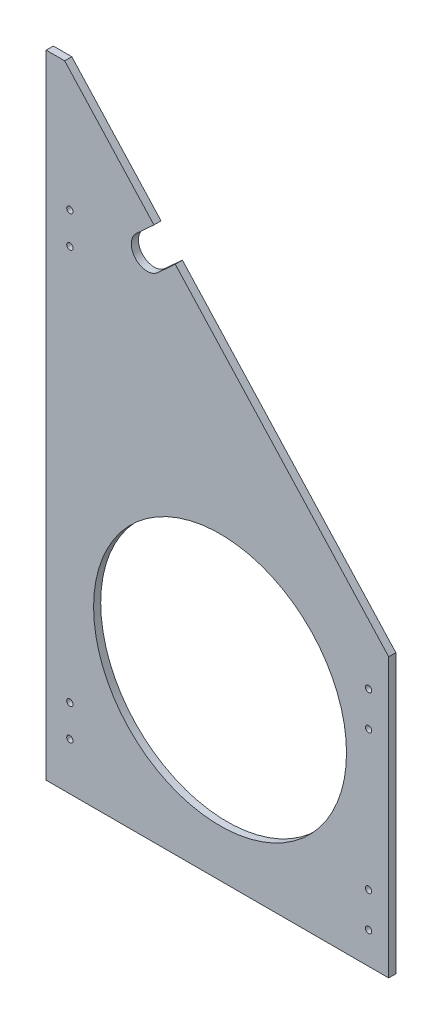
from build123d import *

# Parameters (mm, degrees)
SKETCH_1_R          = 80
EXTRUDE_1_DEPTH     = 4.5
CUT_EXTRUDE_1_REACH = 456.95
SKETCH_2_R          = 2


with BuildPart() as part:
    # 草图1 → 凸台-拉伸1 (new body)
    with BuildSketch(Plane.XY):
        Polygon((0, 0), (216.7, 0), (216.7, 176), (11.7, 400), (0, 400), align=None)
        with Locations((110, 110)):
            Circle(SKETCH_1_R, mode=Mode.SUBTRACT)
    extrude(amount=EXTRUDE_1_DEPTH)

    # 草图2 → 切除-拉伸1 (cut, up to next)
    with BuildSketch(Plane.XY.offset(4.5), mode=Mode.PRIVATE) as cut_extrude_1_sk1:
        with Locations((203.95, 20)):
            Circle(SKETCH_2_R)
    cut_extrude_1_tool1 = extrude(cut_extrude_1_sk1.sketch, amount=-CUT_EXTRUDE_1_REACH, mode=Mode.PRIVATE) & part.part
    # 草图2 → 切除-拉伸1 (cut, up to next)
    with BuildSketch(Plane.XY.offset(4.5), mode=Mode.PRIVATE) as cut_extrude_1_sk2:
        with Locations((203.95, 42)):
            Circle(SKETCH_2_R)
    cut_extrude_1_tool2 = extrude(cut_extrude_1_sk2.sketch, amount=-CUT_EXTRUDE_1_REACH, mode=Mode.PRIVATE) & part.part
    # 草图2 → 切除-拉伸1 (cut, up to next)
    with BuildSketch(Plane.XY.offset(4.5), mode=Mode.PRIVATE) as cut_extrude_1_sk3:
        with Locations((203.95, 130)):
            Circle(SKETCH_2_R)
    cut_extrude_1_tool3 = extrude(cut_extrude_1_sk3.sketch, amount=-CUT_EXTRUDE_1_REACH, mode=Mode.PRIVATE) & part.part
    # 草图2 → 切除-拉伸1 (cut, up to next)
    with BuildSketch(Plane.XY.offset(4.5), mode=Mode.PRIVATE) as cut_extrude_1_sk4:
        with Locations((203.95, 152)):
            Circle(SKETCH_2_R)
    cut_extrude_1_tool4 = extrude(cut_extrude_1_sk4.sketch, amount=-CUT_EXTRUDE_1_REACH, mode=Mode.PRIVATE) & part.part
    # 草图2 → 切除-拉伸1 (cut, up to next)
    with BuildSketch(Plane.XY.offset(4.5), mode=Mode.PRIVATE) as cut_extrude_1_sk5:
        with Locations((15, 30)):
            Circle(SKETCH_2_R)
    cut_extrude_1_tool5 = extrude(cut_extrude_1_sk5.sketch, amount=-CUT_EXTRUDE_1_REACH, mode=Mode.PRIVATE) & part.part
    # 草图2 → 切除-拉伸1 (cut, up to next)
    with BuildSketch(Plane.XY.offset(4.5), mode=Mode.PRIVATE) as cut_extrude_1_sk6:
        with Locations((15, 50)):
            Circle(SKETCH_2_R)
    cut_extrude_1_tool6 = extrude(cut_extrude_1_sk6.sketch, amount=-CUT_EXTRUDE_1_REACH, mode=Mode.PRIVATE) & part.part
    # 草图2 → 切除-拉伸1 (cut, up to next)
    with BuildSketch(Plane.XY.offset(4.5), mode=Mode.PRIVATE) as cut_extrude_1_sk7:
        with Locations((15, 300)):
            Circle(SKETCH_2_R)
    cut_extrude_1_tool7 = extrude(cut_extrude_1_sk7.sketch, amount=-CUT_EXTRUDE_1_REACH, mode=Mode.PRIVATE) & part.part
    # 草图2 → 切除-拉伸1 (cut, up to next)
    with BuildSketch(Plane.XY.offset(4.5), mode=Mode.PRIVATE) as cut_extrude_1_sk8:
        with Locations((15, 320)):
            Circle(SKETCH_2_R)
    cut_extrude_1_tool8 = extrude(cut_extrude_1_sk8.sketch, amount=-CUT_EXTRUDE_1_REACH, mode=Mode.PRIVATE) & part.part
    # 草图2 → 切除-拉伸1 (cut, up to next)
    with BuildSketch(Plane.XY.offset(4.5), mode=Mode.PRIVATE) as cut_extrude_1_sk9:
        with BuildLine():
            Line((57.106354887, 328.167238391), (68.171865568, 338.294156648))
            Line((68.171865568, 338.294156648), (81.674423243, 323.540142407))
            Line((81.674423243, 323.540142407), (70.608912563, 313.41322415))
            ThreePointArc((70.608912563, 313.41322415), (56.480626605, 314.038952433), (57.106354887, 328.167238391))
        make_face()
    cut_extrude_1_tool9 = extrude(cut_extrude_1_sk9.sketch, amount=-CUT_EXTRUDE_1_REACH, mode=Mode.PRIVATE) & part.part
    add(cut_extrude_1_tool1.solids().sort_by_distance((203.95, 20, 4.5))[0], mode=Mode.SUBTRACT)
    add(cut_extrude_1_tool2.solids().sort_by_distance((203.95, 42, 4.5))[0], mode=Mode.SUBTRACT)
    add(cut_extrude_1_tool3.solids().sort_by_distance((203.95, 130, 4.5))[0], mode=Mode.SUBTRACT)
    add(cut_extrude_1_tool4.solids().sort_by_distance((203.95, 152, 4.5))[0], mode=Mode.SUBTRACT)
    add(cut_extrude_1_tool5.solids().sort_by_distance((15, 30, 4.5))[0], mode=Mode.SUBTRACT)
    add(cut_extrude_1_tool6.solids().sort_by_distance((15, 50, 4.5))[0], mode=Mode.SUBTRACT)
    add(cut_extrude_1_tool7.solids().sort_by_distance((15, 300, 4.5))[0], mode=Mode.SUBTRACT)
    add(cut_extrude_1_tool8.solids().sort_by_distance((15, 320, 4.5))[0], mode=Mode.SUBTRACT)
    add(cut_extrude_1_tool9.solids().sort_by_distance((66.413044, 323.128888, 4.5))[0], mode=Mode.SUBTRACT)


solid = part.part
